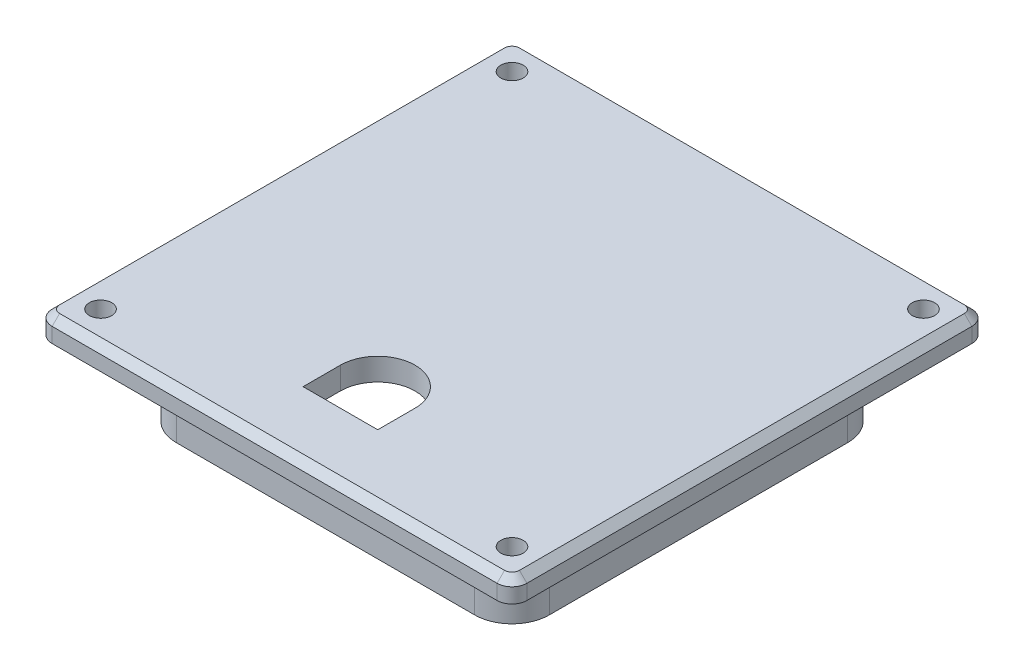
from build123d import *

# Parameters (mm, degrees)
SKETCH1_W           = 50
SKETCH1_H           = 50
SKETCH1_W_2         = 46
SKETCH1_H_2         = 46
BOSS_EXTRUDE1_DEPTH = 10
SKETCH2_W           = 63.639610306
SKETCH2_H           = 63.639610306
SKETCH2_R           = 1.5
BOSS_EXTRUDE2_DEPTH = 3
FILLET2_R           = 5
FILLET3_R           = 2
CHAMFER2_SIZE       = 1


with BuildPart() as part:
    # Sketch1 → Boss-Extrude1 (new body)
    with BuildSketch(Plane(origin=(0, 0, 0), x_dir=(1, 0, 0), z_dir=(0, 1, 0))):
        Rectangle(SKETCH1_W, SKETCH1_H)
        Rectangle(SKETCH1_W_2, SKETCH1_H_2, mode=Mode.SUBTRACT)
    extrude(amount=BOSS_EXTRUDE1_DEPTH)

    # Sketch2 → Boss-Extrude2 (add)
    with BuildSketch(Plane(origin=(0, 10, 0), x_dir=(1, 0, 0), z_dir=(0, 1, 0))):
        Rectangle(SKETCH2_W, SKETCH2_H)
        with Locations(Location((-27.577164466, 27.577164466, 0), (0, 0, 270))):
            Circle(SKETCH2_R, mode=Mode.SUBTRACT)
        with Locations(Location((27.577164466, 27.577164466, 0), (0, 0, 270))):
            Circle(SKETCH2_R, mode=Mode.SUBTRACT)
        with Locations(Location((-27.577164466, -27.577164466, 0), (0, 0, 270))):
            Circle(SKETCH2_R, mode=Mode.SUBTRACT)
        with Locations(Location((27.577164466, -27.577164466, 0), (0, 0, 270))):
            Circle(SKETCH2_R, mode=Mode.SUBTRACT)
        with BuildLine():
            Line((-5, -23), (5, -23))
            Line((5, -23), (5, -18))
            ThreePointArc((5, -18), (0, -13), (-5, -18))
            Line((-5, -18), (-5, -23))
        make_face(mode=Mode.SUBTRACT)
    extrude(amount=BOSS_EXTRUDE2_DEPTH)

    # Fillet2
    fillet2_edges = [part.edges().sort_by_distance(p)[0] for p in [
        (-25, 5, -25),
        (25, 5, -25),
        (25, 5, 25),
        (-25, 5, 25),
    ]]
    fillet(fillet2_edges, radius=FILLET2_R)

    # Fillet3
    fillet3_edges = [part.edges().sort_by_distance(p)[0] for p in [
        (31.819805153, 11.5, 31.819805153),
        (31.819805153, 11.5, -31.819805153),
        (-31.819805153, 11.5, -31.819805153),
        (-31.819805153, 11.5, 31.819805153),
    ]]
    fillet(fillet3_edges, radius=FILLET3_R)

    # Chamfer2
    chamfer2_edges = [part.edges().sort_by_distance(p)[0] for p in [
        (31.234018716, 13, -31.234018716),
        (0, 13, -31.819805153),
        (31.819805153, 13, 0),
        (-31.819805153, 13, 0),
        (0, 13, 31.819805153),
        (31.234018716, 13, 31.234018716),
        (-31.234018716, 13, 31.234018716),
        (-31.234018716, 13, -31.234018716),
    ]]
    chamfer(chamfer2_edges, length=CHAMFER2_SIZE)


solid = part.part
